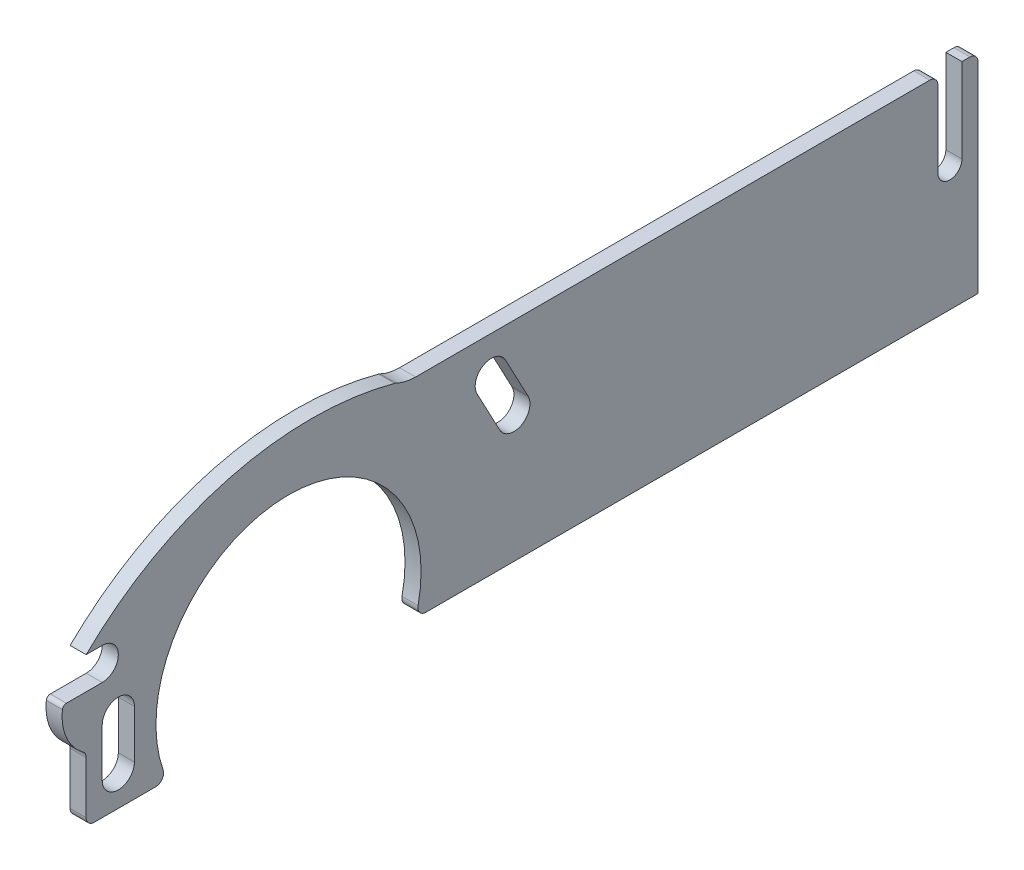
from build123d import *

# Parameters (mm, degrees)
RESSALTO_EXTRUS_O1_DEPTH = 2


with BuildPart() as part:
    # Esboço1 → Ressalto-extrusão1 (new body)
    with BuildSketch(Plane(origin=(0, 0, 0), x_dir=(0, 0, -1), z_dir=(1, 0, 0))):
        with BuildLine():
            Line((0, 0), (0, 25))
            ThreePointArc((0, 25), (-0.292893219, 25.707106781), (-1, 26))
            Line((-1, 26), (-2, 26))
            Line((-2, 26), (-2, 15.5))
            ThreePointArc((-2, 15.5), (-3.5, 14), (-5, 15.5))
            Line((-5, 15.5), (-5, 25))
            ThreePointArc((-5, 25), (-5.292893219, 25.707106781), (-6, 26))
            Line((-6, 26), (-70, 26))
            ThreePointArc((-70, 26), (-71.248507537, 26.141106905), (-72.434027777, 26.557308768))
            ThreePointArc((-72.434027777, 26.557308768), (-72.519947834, 26.593984538), (-72.608915487, 26.622482343))
            ThreePointArc((-72.608915487, 26.622482343), (-93.139545948, 26.696407833), (-111, 16.571367926))
            Line((-111, 16.571367926), (-109, 16.571367926))
            ThreePointArc((-109, 16.571367926), (-107, 14.571367926), (-109, 12.571367926))
            Line((-109, 12.571367926), (-113.466213279, 12.571367926))
            ThreePointArc((-113.466213279, 12.571367926), (-113.800393506, 12.443286702), (-113.963364883, 12.124662231))
            ThreePointArc((-113.963364883, 12.124662231), (-113.460397939, 8.860641338), (-111.403723296, 6.276671998))
            ThreePointArc((-111.403723296, 6.276671998), (-111.106614108, 5.923183177), (-111, 5.473893017))
            Line((-111, 5.473893017), (-111, -1))
            ThreePointArc((-111, -1), (-110.707106781, -1.707106781), (-110, -2))
            Line((-110, -2), (-102.358378421, -2))
            ThreePointArc((-102.358378421, -2), (-101.544115198, -1.580495826), (-101.413025617, -0.673950808))
            ThreePointArc((-101.413025617, -0.673950808), (-86.793753315, 21.176788674), (-69.688908754, 1.211763478))
            ThreePointArc((-69.688908754, 1.211763478), (-69.489971865, 0.372211611), (-68.711587809, 0))
            Line((-68.711587809, 0), (0, 0))
        make_face()
        with BuildLine():
            Line((-105, 8), (-105, 2))
            ThreePointArc((-105, 2), (-107, 0), (-109, 2))
            Line((-109, 2), (-109, 8))
            ThreePointArc((-109, 8), (-107, 10), (-105, 8))
        make_face(mode=Mode.SUBTRACT)
        with BuildLine():
            Line((-58.816829377, 22.236628683), (-56, 16.938943126))
            ThreePointArc((-56, 16.938943126), (-56.82695206, 14.234104814), (-59.531790371, 15.061056874))
            Line((-59.531790371, 15.061056874), (-62.348619748, 20.358742432))
            ThreePointArc((-62.348619748, 20.358742432), (-61.521667688, 23.063580743), (-58.816829377, 22.236628683))
        make_face(mode=Mode.SUBTRACT)
    extrude(amount=RESSALTO_EXTRUS_O1_DEPTH)


solid = part.part
